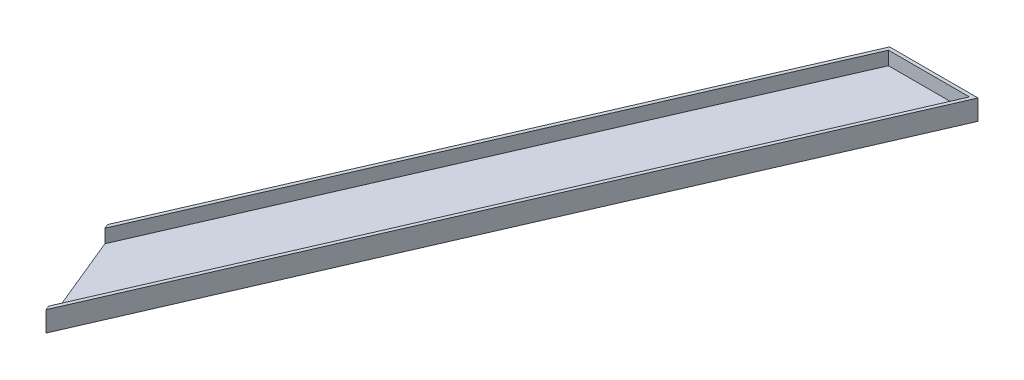
from build123d import *

# Parameters (mm, degrees)
EXTRUDE_1_DEPTH      = 1
EXTRUDE_2_DEPTH      = 2
EXTRUDE_2_DEPTH_BACK = 1
EXTRUDE_4_DEPTH      = 2
EXTRUDE_4_DEPTH_BACK = 1
EXTRUDE_5_DEPTH      = 2


with BuildPart() as part:
    # 草圖1 → 填料-伸長1 (new body)
    with BuildSketch(Plane(origin=(0, 0, 0), x_dir=(1, 0, 0), z_dir=(0, 1, 0))):
        Polygon((0, 0), (-5.8291827, 14.170729157), (29.567552432, 95.5), (41.564226141, 95.5), align=None)
    extrude(amount=EXTRUDE_1_DEPTH)



with BuildPart() as body_2:
    # 草圖2 → 填料-伸長2 (new, two sides: drawn at the far end of the back side and taken through both)
    with BuildSketch(Plane(origin=(0, 1, 0), x_dir=(1, 0, 0), z_dir=(0, 1, 0)).offset(-EXTRUDE_2_DEPTH_BACK)):
        Polygon((0, 0), (41.564226141, 95.5), (42.109529491, 95.5), (0.26496285, -0.644124053), align=None)
    extrude(amount=EXTRUDE_2_DEPTH + EXTRUDE_2_DEPTH_BACK)


with BuildPart() as part_1:
    add(part.part)

    add(body_2.part)  # 填料-伸長4 merges body 2
    # 草圖2<4> → 填料-伸長4 (add, two sides: drawn at the far end of the back side and taken through both)
    with BuildSketch(Plane(origin=(0, 1, 0), x_dir=(1, 0, 0), z_dir=(0, 1, 0)).offset(-EXTRUDE_4_DEPTH_BACK)):
        Polygon((-5.8291827, 14.170729157), (29.567552432, 95.5), (29.022249082, 95.5), (-6.09414555, 14.81485321), align=None)
    extrude(amount=EXTRUDE_4_DEPTH + EXTRUDE_4_DEPTH_BACK)

    # 草圖7 → 填料-伸長5 (add)
    with BuildSketch(Plane(origin=(0, 1, 0), x_dir=(1, 0, 0), z_dir=(0, 1, 0))):
        Polygon((41.564226141, 95.5), (29.567552432, 95.5), (29.349938683, 95), (41.346612391, 95), align=None)
    extrude(amount=EXTRUDE_5_DEPTH)


solid = part_1.part
